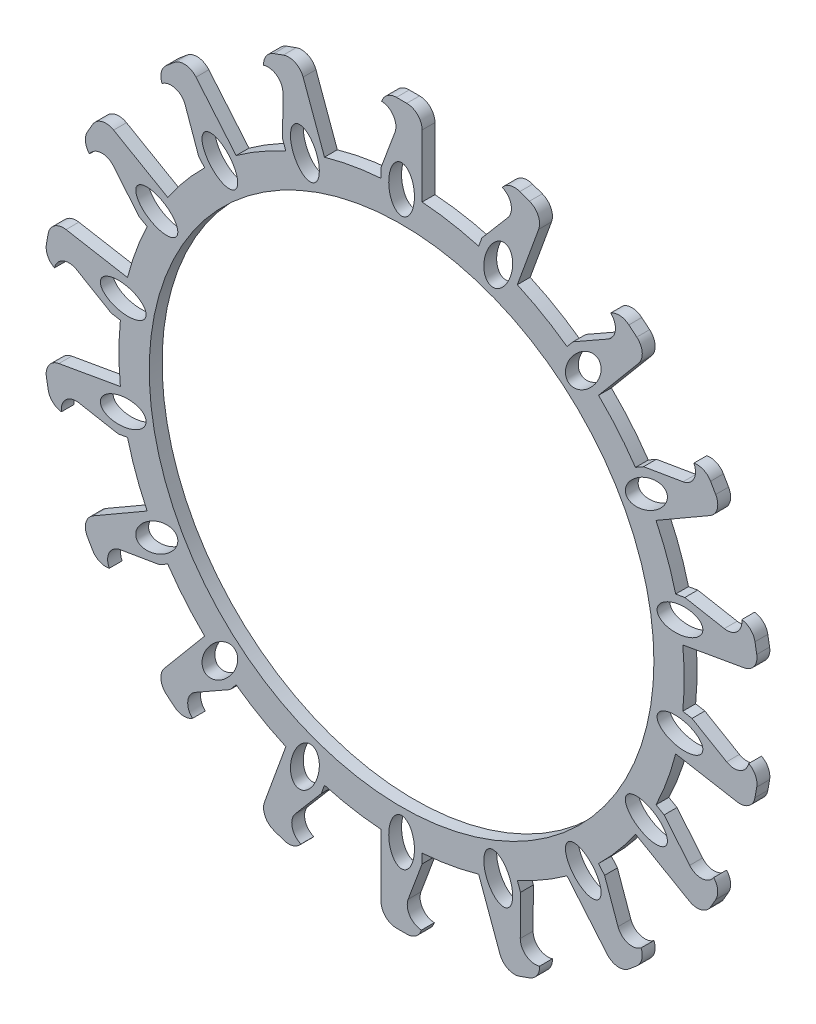
from build123d import *

# Parameters (mm, degrees)
SKETCH1_R           = 69.85
SKETCH1_R_2         = 55.245
BOSS_EXTRUDE1_DEPTH = 3.175
BOSS_EXTRUDE2_DEPTH = 3.175
FILLET4_R           = 3.81
CUT_EXTRUDE1_DEPTH  = 134.459474302
SKETCH4_RX          = 5.715
SKETCH4_RY          = 3.175
CUT_EXTRUDE2_DEPTH  = 134.459474302
CIRPATTERN2_COUNT   = 18
SKETCH5_R           = 62.357
CUT_EXTRUDE5_DEPTH  = 134.459474446


with BuildPart() as part:
    # Sketch1 → Boss-Extrude1 (new body)
    with BuildSketch(Plane.XY):
        with Locations((-8.548720341, -3.365444156)):
            Circle(SKETCH1_R)
        with Locations((-8.548720341, -3.365444156)):
            Circle(SKETCH1_R_2, mode=Mode.SUBTRACT)
    extrude(amount=BOSS_EXTRUDE1_DEPTH)

    # Sketch2 → Boss-Extrude2 (add)
    with BuildSketch(Plane(origin=(0, 0, 3.175), x_dir=(-1, 0, 0), z_dir=(0, 0, -1))):
        Polygon((8.548720341, 62.674555844), (13.628720341, 62.674555844), (13.628720341, 85.534555844), (3.468720341, 85.534555844), (3.468720341, 62.674555844), align=None)
        Polygon((34.180672569, 81.91069216), (43.727949596, 78.435767503), (35.90936912, 56.954394192), (31.135730606, 58.69185652), (26.362092093, 60.429318849), align=None)
        Polygon((61.801033071, 68.001267894), (69.584044613, 61.47054578), (54.889919856, 43.95876981), (50.998414085, 47.224130867), (47.106908314, 50.489491924), align=None)
        Polygon((82.998378738, 45.483964895), (88.078378738, 36.685146792), (68.281038007, 25.255146792), (65.741038007, 29.654555844), (63.201038007, 34.053964895), align=None)
        Polygon((95.215996841, 17.074702224), (96.980262327, 7.069055453), (74.467557093, 3.099458112), (73.58542435, 8.102281497), (72.703291608, 13.105104882), align=None)
        Polygon((96.980262327, -13.799943766), (95.215996841, -23.805590536), (72.703291608, -19.835993195), (73.58542435, -14.833169809), (74.467557093, -9.830346424), align=None)
        Polygon((88.078378738, -43.416035105), (82.998378738, -52.214853208), (63.201038007, -40.784853208), (65.741038007, -36.385444156), (68.281038007, -31.986035105), align=None)
        Polygon((69.584044613, -68.201434092), (61.801033071, -74.732156207), (47.106908314, -57.220380237), (50.998414085, -53.95501918), (54.889919856, -50.689658123), align=None)
        Polygon((43.727949596, -85.166655816), (34.180672569, -88.641580472), (26.362092093, -67.160207161), (31.135730606, -65.422744833), (35.90936912, -63.685282505), align=None)
        Polygon((13.628720341, -92.265444156), (3.468720341, -92.265444156), (3.468720341, -69.405444156), (8.548720341, -69.405444156), (13.628720341, -69.405444156), align=None)
        Polygon((-17.083231887, -88.641580472), (-26.630508914, -85.166655816), (-18.811928438, -63.685282505), (-14.038289924, -65.422744833), (-9.26465141, -67.160207161), align=None)
        Polygon((-44.703592389, -74.732156207), (-52.486603931, -68.201434092), (-37.792479174, -50.689658123), (-33.900973402, -53.95501918), (-30.009467631, -57.220380237), align=None)
        Polygon((-65.900938055, -52.214853208), (-70.980938055, -43.416035105), (-51.183597325, -31.986035105), (-48.643597325, -36.385444156), (-46.103597325, -40.784853208), align=None)
        Polygon((-78.118556159, -23.805590536), (-79.882821644, -13.799943766), (-57.37011641, -9.830346424), (-56.487983668, -14.833169809), (-55.605850925, -19.835993195), align=None)
        Polygon((-79.882821644, 7.069055453), (-78.118556159, 17.074702224), (-55.605850925, 13.105104882), (-56.487983668, 8.102281497), (-57.37011641, 3.099458112), align=None)
        Polygon((-70.980938055, 36.685146792), (-65.900938055, 45.483964895), (-46.103597325, 34.053964895), (-48.643597325, 29.654555844), (-51.183597325, 25.255146792), align=None)
        Polygon((-52.486603931, 61.47054578), (-44.703592389, 68.001267894), (-30.009467631, 50.489491924), (-33.900973402, 47.224130867), (-37.792479174, 43.95876981), align=None)
        Polygon((-26.630508914, 78.435767503), (-17.083231887, 81.91069216), (-9.26465141, 60.429318849), (-14.038289924, 58.69185652), (-18.811928438, 56.954394192), align=None)
    extrude(amount=BOSS_EXTRUDE2_DEPTH)

    # Fillet4
    fillet4_edges = [part.edges().sort_by_distance(p)[0] for p in [
        (-82.998378738, 45.483964895, 1.5875),
        (-88.078378738, 36.685146792, 1.5875),
        (-95.215996841, 17.074702224, 1.5875),
        (-96.980262327, 7.069055453, 1.5875),
        (-96.980262327, -13.799943766, 1.5875),
        (-95.215996841, -23.805590536, 1.5875),
        (-88.078378738, -43.416035105, 1.5875),
        (-82.998378738, -52.214853208, 1.5875),
        (-69.584044613, -68.201434092, 1.5875),
        (-61.801033071, -74.732156207, 1.5875),
        (-43.727949596, -85.166655816, 1.5875),
        (-34.180672569, -88.641580472, 1.5875),
        (-13.628720341, -92.265444156, 1.5875),
        (-3.468720341, -92.265444156, 1.5875),
        (17.083231887, -88.641580472, 1.5875),
        (26.630508914, -85.166655816, 1.5875),
        (-3.468720341, 85.534555844, 1.5875),
        (-13.628720341, 85.534555844, 1.5875),
        (44.703592389, -74.732156207, 1.5875),
        (52.486603931, -68.201434092, 1.5875),
        (65.900938055, -52.214853208, 1.5875),
        (70.980938055, -43.416035105, 1.5875),
        (78.118556159, -23.805590536, 1.5875),
        (79.882821644, -13.799943766, 1.5875),
        (79.882821644, 7.069055453, 1.5875),
        (78.118556159, 17.074702224, 1.5875),
        (70.980938055, 36.685146792, 1.5875),
        (65.900938055, 45.483964895, 1.5875),
        (52.486603931, 61.47054578, 1.5875),
        (44.703592389, 68.001267894, 1.5875),
        (26.630508914, 78.435767503, 1.5875),
        (17.083231887, 81.91069216, 1.5875),
        (-34.180672569, 81.91069216, 1.5875),
        (-43.727949596, 78.435767503, 1.5875),
        (-61.801033071, 68.001267894, 1.5875),
        (-69.584044613, 61.47054578, 1.5875),
    ]]
    fillet(fillet4_edges, radius=FILLET4_R)

    # Sketch3 → Cut-Extrude1 (cut, through all)
    with BuildSketch(Plane(origin=(0, 0, 0), x_dir=(-1, 0, 0), z_dir=(0, 0, -1))):
        with BuildLine():
            Line((13.628720341, 68.616049563), (10.176595979, 77.901073709))
            ThreePointArc((10.176595979, 77.901073709), (12.345238207, 82.636680206), (17.080844703, 80.468037978))
            Line((17.080844703, 80.468037978), (20.532969065, 71.183013832))
            ThreePointArc((20.532969065, 71.183013832), (18.364326838, 66.447407336), (13.628720341, 68.616049563))
        make_face()
        with BuildLine():
            Line((37.941479654, 62.537571997), (37.873209154, 72.44333674))
            ThreePointArc((37.873209154, 72.44333674), (41.530739065, 76.151631894), (45.239034219, 72.494101983))
            Line((45.239034219, 72.494101983), (45.307304719, 62.58833724))
            ThreePointArc((45.307304719, 62.58833724), (41.649774808, 58.880042086), (37.941479654, 62.537571997))
        make_face()
        with BuildLine():
            Line((58.709038402, 48.510218058), (62.032856194, 57.841941976))
            ThreePointArc((62.032856194, 57.841941976), (66.738121702, 60.075650664), (68.97183039, 55.370385156))
            Line((68.97183039, 55.370385156), (65.648012597, 46.038661238))
            ThreePointArc((65.648012597, 46.038661238), (60.94274709, 43.80495255), (58.709038402, 48.510218058))
        make_face()
        with BuildLine():
            Line((73.426522505, 28.225893652), (79.741527109, 35.85803312))
            ThreePointArc((79.741527109, 35.85803312), (84.927003751, 36.347737107), (85.416707738, 31.162260465))
            Line((85.416707738, 31.162260465), (79.101703134, 23.530120998))
            ThreePointArc((79.101703134, 23.530120998), (73.916226492, 23.04041701), (73.426522505, 28.225893652))
        make_face()
        with BuildLine():
            Line((80.318786172, 4.131187669), (88.863294833, 9.143194027))
            ThreePointArc((88.863294833, 9.143194027), (93.903537597, 7.829827786), (92.590171356, 2.789585023))
            Line((92.590171356, 2.789585023), (84.045662695, -2.222421336))
            ThreePointArc((84.045662695, -2.222421336), (79.005419931, -0.909055095), (80.318786172, 4.131187669))
        make_face()
        with BuildLine():
            Line((78.554520687, -20.867722752), (88.297939557, -19.080371438))
            ThreePointArc((88.297939557, -19.080371438), (92.58502078, -22.038396556), (89.626995662, -26.325477778))
            Line((89.626995662, -26.325477778), (79.883576792, -28.112829091))
            ThreePointArc((79.883576792, -28.112829091), (75.59649557, -25.154803974), (78.554520687, -20.867722752))
        make_face()
        with BuildLine():
            Line((68.346522505, -43.755600067), (78.113651471, -45.408484746))
            ThreePointArc((78.113651471, -45.408484746), (81.130485885, -49.654387255), (76.884583377, -52.671221669))
            Line((76.884583377, -52.671221669), (67.11745441, -51.018336991))
            ThreePointArc((67.11745441, -51.018336991), (64.100619996, -46.772434482), (68.346522505, -43.755600067))
        make_face()
        with BuildLine():
            Line((50.92602686, -61.771828485), (59.538806021, -66.665586869))
            ThreePointArc((59.538806021, -66.665586869), (60.921518874, -71.687248264), (55.899857479, -73.069961117))
            Line((55.899857479, -73.069961117), (47.287078318, -68.176202733))
            ThreePointArc((47.287078318, -68.176202733), (45.904365465, -63.154541338), (50.92602686, -61.771828485))
        make_face()
        with BuildLine():
            Line((28.394202626, -72.743384966), (34.813803704, -80.28775757))
            ThreePointArc((34.813803704, -80.28775757), (34.395619419, -85.479491376), (29.203885614, -85.06130709))
            Line((29.203885614, -85.06130709), (22.784284536, -77.516934485))
            ThreePointArc((22.784284536, -77.516934485), (23.202468821, -72.32520068), (28.394202626, -72.743384966))
        make_face()
        with BuildLine():
            Line((3.468720341, -75.346937876), (6.920844703, -84.631962022))
            ThreePointArc((6.920844703, -84.631962022), (4.752202476, -89.367568518), (0.016595979, -87.198926291))
            Line((0.016595979, -87.198926291), (-3.435528383, -77.913902145))
            ThreePointArc((-3.435528383, -77.913902145), (-1.266886155, -73.178295648), (3.468720341, -75.346937876))
        make_face()
        with BuildLine():
            Line((-20.844038971, -69.26846031), (-20.775768471, -79.174225052))
            ThreePointArc((-20.775768471, -79.174225052), (-24.433298382, -82.882520207), (-28.141593536, -79.224990296))
            Line((-28.141593536, -79.224990296), (-28.209864036, -69.319225553))
            ThreePointArc((-28.209864036, -69.319225553), (-24.552334125, -65.610930399), (-20.844038971, -69.26846031))
        make_face()
        with BuildLine():
            Line((-41.611597719, -55.24110637), (-44.935415512, -64.572830288))
            ThreePointArc((-44.935415512, -64.572830288), (-49.640681019, -66.806538976), (-51.874389707, -62.101273469))
            Line((-51.874389707, -62.101273469), (-48.550571915, -52.76954955))
            ThreePointArc((-48.550571915, -52.76954955), (-43.845306407, -50.535840863), (-41.611597719, -55.24110637))
        make_face()
        with BuildLine():
            Line((-56.329081822, -34.956781965), (-62.644086426, -42.588921432))
            ThreePointArc((-62.644086426, -42.588921432), (-67.829563068, -43.07862542), (-68.319267056, -37.893148778))
            Line((-68.319267056, -37.893148778), (-62.004262452, -30.26100931))
            ThreePointArc((-62.004262452, -30.26100931), (-56.81878581, -29.771305323), (-56.329081822, -34.956781965))
        make_face()
        with BuildLine():
            Line((-63.22134549, -10.862075981), (-71.765854151, -15.87408234))
            ThreePointArc((-71.765854151, -15.87408234), (-76.806096915, -14.560716099), (-75.492730674, -9.520473335))
            Line((-75.492730674, -9.520473335), (-66.948222013, -4.508466977))
            ThreePointArc((-66.948222013, -4.508466977), (-61.907979249, -5.821833217), (-63.22134549, -10.862075981))
        make_face()
        with BuildLine():
            Line((-61.457080005, 14.136834439), (-71.200498875, 12.349483126))
            ThreePointArc((-71.200498875, 12.349483126), (-75.487580097, 15.307508243), (-72.52955498, 19.594589465))
            Line((-72.52955498, 19.594589465), (-62.78613611, 21.381940779))
            ThreePointArc((-62.78613611, 21.381940779), (-58.499054887, 18.423915661), (-61.457080005, 14.136834439))
        make_face()
        with BuildLine():
            Line((-51.249081822, 37.024711755), (-61.016210788, 38.677596433))
            ThreePointArc((-61.016210788, 38.677596433), (-64.033045203, 42.923498942), (-59.787142694, 45.940333357))
            Line((-59.787142694, 45.940333357), (-50.020013728, 44.287448678))
            ThreePointArc((-50.020013728, 44.287448678), (-47.003179313, 40.041546169), (-51.249081822, 37.024711755))
        make_face()
        with BuildLine():
            Line((-33.828586177, 55.040940172), (-42.441365338, 59.934698556))
            ThreePointArc((-42.441365338, 59.934698556), (-43.824078191, 64.956359951), (-38.802416796, 66.339072804))
            Line((-38.802416796, 66.339072804), (-30.189637635, 61.44531442))
            ThreePointArc((-30.189637635, 61.44531442), (-28.806924782, 56.423653025), (-33.828586177, 55.040940172))
        make_face()
        with BuildLine():
            Line((-11.296761944, 66.012496653), (-17.716363022, 73.556869258))
            ThreePointArc((-17.716363022, 73.556869258), (-17.298178737, 78.748603063), (-12.106444931, 78.330418777))
            Line((-12.106444931, 78.330418777), (-5.686843853, 70.786046173))
            ThreePointArc((-5.686843853, 70.786046173), (-6.105028139, 65.594312368), (-11.296761944, 66.012496653))
        make_face()
    extrude(amount=-CUT_EXTRUDE1_DEPTH, mode=Mode.SUBTRACT)

    # Sketch4 → Cut-Extrude2 (cut, through all)
    with BuildSketch(Plane(origin=(0, 0, 0), x_dir=(-1, 0, 0), z_dir=(0, 0, -1))):
        with Locations(Location((8.548720341, 66.484555844), (0, 0, 90))):
            Ellipse(SKETCH4_RX, SKETCH4_RY)
    cut_extrude2 = extrude(amount=-CUT_EXTRUDE2_DEPTH, mode=Mode.SUBTRACT)

    # CirPattern2: Cut-Extrude2 ×18 about axis
    cirpattern2_axis = Axis((-8.548720341, -3.365444156, 0), (0, 0, 1))
    for i in range(1, CIRPATTERN2_COUNT):
        add(cut_extrude2.rotate(cirpattern2_axis, i * 360 / CIRPATTERN2_COUNT), mode=Mode.SUBTRACT)

    # Sketch5 → Cut-Extrude5 (cut, through all)
    with BuildSketch(Plane.XY.offset(3.175)):
        with Locations((-8.548720341, -3.365444156)):
            Circle(SKETCH5_R)
    extrude(amount=-CUT_EXTRUDE5_DEPTH, mode=Mode.SUBTRACT)


solid = part.part
